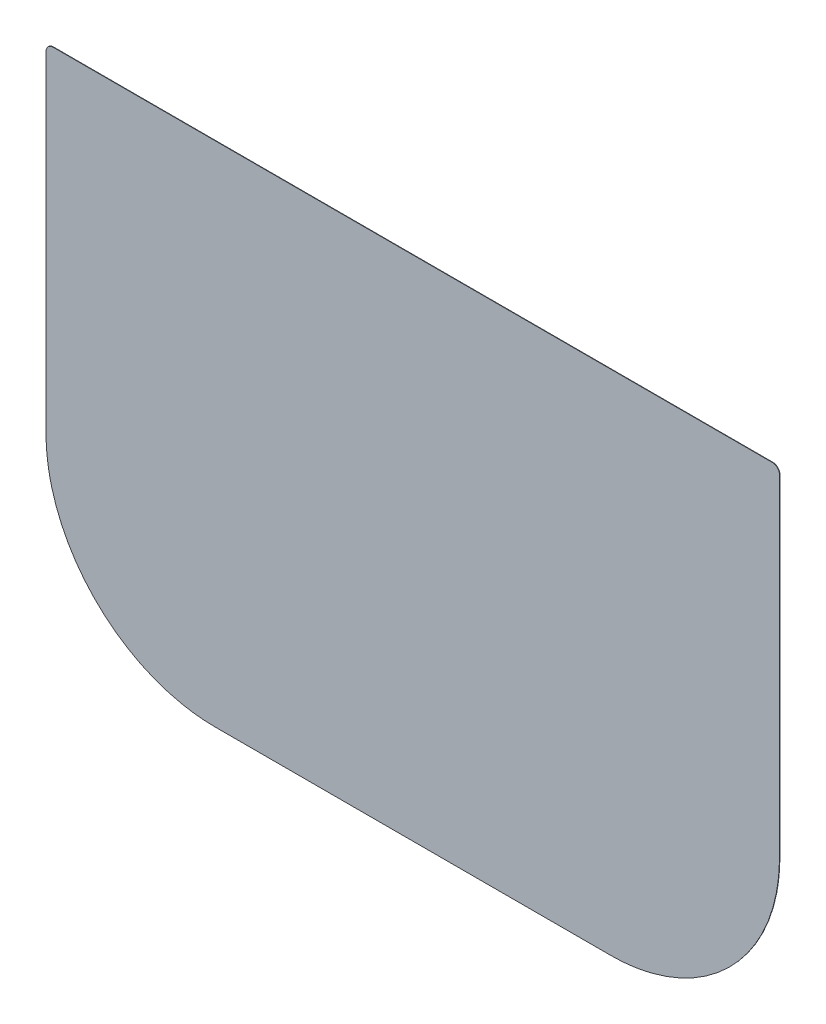
from build123d import *

# Parameters (mm, degrees)
BOSS_EXTRUDE1_DEPTH = 0.2


with BuildPart() as part:
    # Model → Boss-Extrude1 (new body)
    with BuildSketch(Plane.XY):
        with BuildLine():
            Line((311.4628, 29.156659), (133.877646, 29.156659))
            ThreePointArc((133.877646, 29.156659), (126.397157508, 29.518924603), (118.987614901, 30.608705684))
            ThreePointArc((118.987614901, 30.608705684), (106.409010734, 34.249903459), (94.644869283, 40.001823133))
            ThreePointArc((94.644869283, 40.001823133), (79.265467697, 52.17043009), (67.475756788, 67.842178719))
            ThreePointArc((67.475756788, 67.842178719), (63.186343849, 76.684502016), (60.075481308, 86.006963006))
            ThreePointArc((60.075481308, 86.006963006), (58.980656761, 90.799830304), (58.197680672, 95.65340282))
            ThreePointArc((58.197680672, 95.65340282), (57.729553743, 100.547315285), (57.573226, 105.46108))
            Line((57.573226, 105.46108), (57.573226, 254.57742))
            ThreePointArc((57.573226, 254.57742), (58.504327705, 256.825551588), (60.752459, 257.756654))
            Line((60.752459, 257.756654), (384.593985, 257.756654))
            ThreePointArc((384.593985, 257.756654), (386.842050539, 256.825485831), (387.773218, 254.57742))
            Line((387.773218, 254.57742), (387.773218, 105.467077))
            ThreePointArc((387.773218, 105.467077), (387.410880841, 97.986010389), (386.32106007, 90.575886467))
            ThreePointArc((386.32106007, 90.575886467), (382.679524191, 77.996258298), (376.927164051, 66.23113266))
            ThreePointArc((376.927164051, 66.23113266), (364.757582557, 50.850607234), (349.084681404, 39.059956465))
            ThreePointArc((349.084681404, 39.059956465), (340.241641266, 34.770275582), (330.918478465, 31.659109186))
            ThreePointArc((330.918478465, 31.659109186), (326.125220503, 30.5642449), (321.271270405, 29.781162436))
            ThreePointArc((321.271270405, 29.781162436), (316.376958763, 29.313050964), (311.4628, 29.156659))
        make_face()
    extrude(amount=BOSS_EXTRUDE1_DEPTH)


solid = part.part
